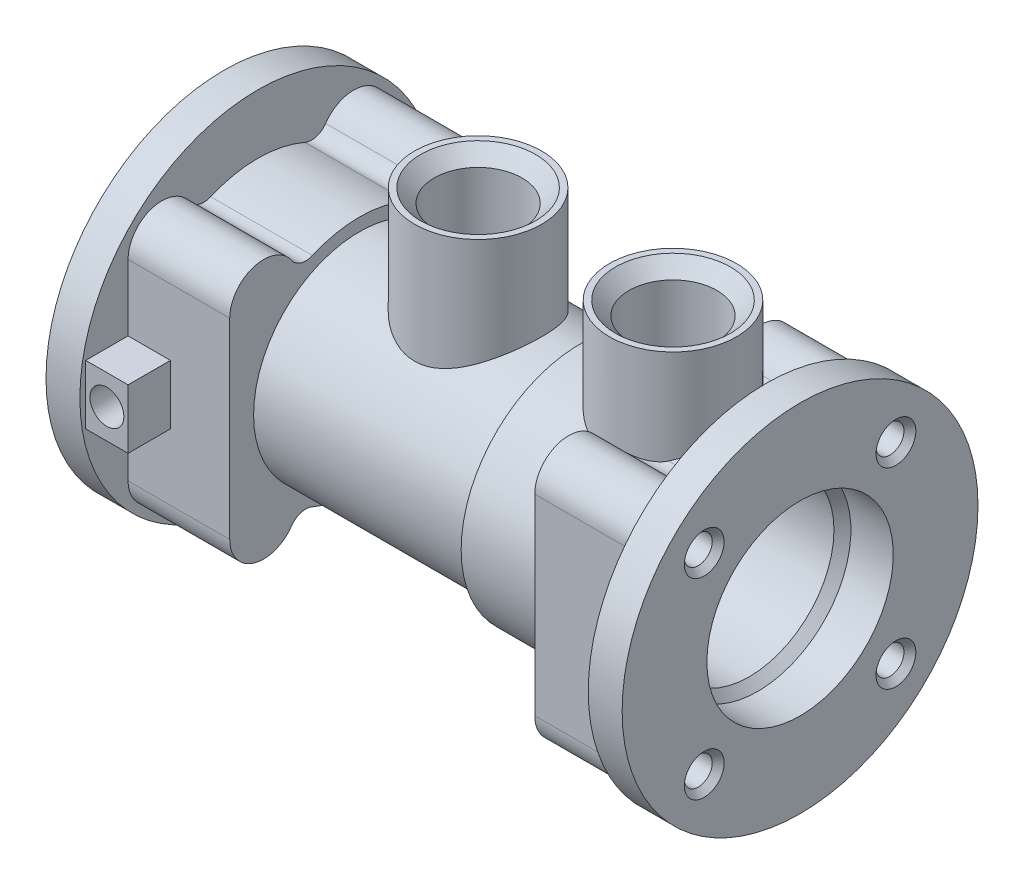
from build123d import *

# Parameters (mm, degrees)
EXTRUDE_1_DEPTH                 = 12
EXTRUDE_START                   = 12
EXTRUDE_2_DEPTH                 = 12
EXTRUDE_3_REACH                 = 86.202
EXTRUDE_3_END_RADIUS            = 12.5
SKETCH_4_R                      = 7.5
CUT_EXTRUDE_1_REACH             = 86.202
SKETCH_5_R                      = 5.188
CHAMFER_1_SIZE                  = 1.6
HOLE_WIZARD_M41_D               = 3.3
HOLE_WIZARD_M41_DEPTH           = 12
HOLE_WIZARD_M41_TIP             = 0.991420021
HOLE_WIZARD_M41_ON_FACE_2_D     = 3.3
HOLE_WIZARD_M41_ON_FACE_2_DEPTH = 12
HOLE_WIZARD_M41_ON_FACE_2_TIP   = 0.991420021
SKETCH_11_W                     = 5
SKETCH_11_H                     = 7
EXTRUDE_4_DEPTH                 = 5
CUT_EXTRUDE_2_REACH             = 85.107
CUT_EXTRUDE_2_END_RADIUS        = 10
SKETCH_12_R                     = 2
CHAMFER_2_SIZE                  = 0.7


with BuildPart() as part:
    # Эскиз1 → Повернуть1 (revolve)
    with BuildSketch(Plane.XY, mode=Mode.PRIVATE) as revolve_1_sk:
        Polygon((0, 21), (0, 11), (7, 11), (8, 10), (35, 10), (35, 9), (36, 9), (36, 8), (40.2, 8), (40.2, 6), (43, 6), (43, 10), (62, 10), (63, 11), (68, 11), (68, 21), (64, 21), (64, 14), (42, 14), (42, 12.5), (11, 12.5), (11, 14), (4, 14), (4, 21), align=None)
    revolve(revolve_1_sk.sketch.rotate(Axis((0, 0, 0), (1, 0, 0)), 90), axis=Axis((0, 0, 0), (1, 0, 0)))

    # Эскиз2 → Бобышка-Вытянуть1 (add)
    with BuildSketch(Plane(origin=(4, 0, 0), x_dir=(0, 0, -1), z_dir=(1, 0, 0))):
        with BuildLine():
            Line((15.313708499, 11.313708499), (15.313708499, 0))
            Line((15.313708499, 0), (12.5, 0))
            ThreePointArc((12.5, 0), (0, 12.5), (-12.5, 0))
            Line((-12.5, 0), (-15.313708499, 0))
            Line((-15.313708499, 0), (-15.313708499, 11.313708499))
            ThreePointArc((-15.313708499, 11.313708499), (-12.489638827, 15.136951607), (-8.005114567, 13.561642259))
            ThreePointArc((-8.005114567, 13.561642259), (-6.909147892, 12.765122929), (-5.556965401, 12.849907997))
            ThreePointArc((-5.556965401, 12.849907997), (0, 14), (5.556965401, 12.849907997))
            ThreePointArc((5.556965401, 12.849907997), (6.909147892, 12.765122929), (8.005114567, 13.561642259))
            ThreePointArc((8.005114567, 13.561642259), (12.489638827, 15.136951607), (15.313708499, 11.313708499))
        make_face()
    extrude_1 = extrude(amount=EXTRUDE_1_DEPTH)

    # Зеркальное отражение6: Бобышка-Вытянуть1 across plane
    add(extrude_1.mirror(Plane(origin=(16, 0, 12.5), x_dir=(0, 0, 1), z_dir=(0, 1, 0))))

    # Эскиз3 → Бобышка-Вытянуть2 (add)
    with BuildSketch(Plane.ZY.offset(-64).offset(EXTRUDE_START)):
        with BuildLine():
            ThreePointArc((8.005114567, 13.561642259), (6.909147892, 12.765122929), (5.556965401, 12.849907997))
            ThreePointArc((5.556965401, 12.849907997), (11.700374259, 7.687733229), (14, 0))
            ThreePointArc((14, 0), (11.700374259, -7.687733229), (5.556965401, -12.849907997))
            ThreePointArc((5.556965401, -12.849907997), (6.909147892, -12.765122929), (8.005114567, -13.561642259))
            ThreePointArc((8.005114567, -13.561642259), (12.489638827, -15.136951607), (15.313708499, -11.313708499))
            Line((15.313708499, -11.313708499), (15.313708499, 11.313708499))
            ThreePointArc((15.313708499, 11.313708499), (12.489638827, 15.136951607), (8.005114567, 13.561642259))
        make_face()
        with BuildLine():
            ThreePointArc((-8.005114567, 13.561642259), (-12.489638827, 15.136951607), (-15.313708499, 11.313708499))
            Line((-15.313708499, 11.313708499), (-15.313708499, -11.313708499))
            ThreePointArc((-15.313708499, -11.313708499), (-12.489638827, -15.136951607), (-8.005114567, -13.561642259))
            ThreePointArc((-8.005114567, -13.561642259), (-6.909147892, -12.765122929), (-5.556965401, -12.849907997))
            ThreePointArc((-5.556965401, -12.849907997), (-14, 0), (-5.556965401, 12.849907997))
            ThreePointArc((-5.556965401, 12.849907997), (-6.909147892, 12.765122929), (-8.005114567, 13.561642259))
        make_face()
    extrude(amount=-EXTRUDE_2_DEPTH)

    # Бобышка-Вытянуть3: up to this cylinder (the profile starts outside it)
    extrude_3_end = Plane(origin=(41.5, 0, 0), z_dir=(-1, 0, 0)) * Cylinder(EXTRUDE_3_END_RADIUS, 221.404, mode=Mode.PRIVATE)
    # Эскиз4 → Бобышка-Вытянуть3 (add, up to the surface)
    with BuildSketch(Plane(origin=(0, 24, 0), x_dir=(1, 0, 0), z_dir=(0, 1, 0)), mode=Mode.PRIVATE) as extrude_3_sk1:
        with Locations(Location((30, 0, 0), (0, 0, 270))):
            Circle(SKETCH_4_R)
    extrude_3_tool1 = extrude(extrude_3_sk1.sketch, amount=-EXTRUDE_3_REACH, mode=Mode.PRIVATE) - extrude_3_end
    add(extrude_3_tool1.solids().sort_by_distance((30, 24, 0))[0])
    # Эскиз4 → Бобышка-Вытянуть3 (add, up to the surface)
    with BuildSketch(Plane(origin=(0, 24, 0), x_dir=(1, 0, 0), z_dir=(0, 1, 0)), mode=Mode.PRIVATE) as extrude_3_sk2:
        with Locations(Location((53, 0, 0), (0, 0, 270))):
            Circle(SKETCH_4_R)
    extrude_3_tool2 = extrude(extrude_3_sk2.sketch, amount=-EXTRUDE_3_REACH, mode=Mode.PRIVATE) - extrude_3_end
    add(extrude_3_tool2.solids().sort_by_distance((53, 24, 0))[0])

    # Эскиз5 → Вырез-Вытянуть1 (cut, up to next)
    with BuildSketch(Plane(origin=(0, 24, 0), x_dir=(1, 0, 0), z_dir=(0, 1, 0)), mode=Mode.PRIVATE) as cut_extrude_1_sk1:
        with Locations(Location((53, 0, 0), (0, 0, 270))):
            Circle(SKETCH_5_R)
    cut_extrude_1_tool1 = extrude(cut_extrude_1_sk1.sketch, amount=-CUT_EXTRUDE_1_REACH, mode=Mode.PRIVATE) & part.part
    # Эскиз5 → Вырез-Вытянуть1 (cut, up to next)
    with BuildSketch(Plane(origin=(0, 24, 0), x_dir=(1, 0, 0), z_dir=(0, 1, 0)), mode=Mode.PRIVATE) as cut_extrude_1_sk2:
        with Locations(Location((30, 0, 0), (0, 0, 270))):
            Circle(SKETCH_5_R)
    cut_extrude_1_tool2 = extrude(cut_extrude_1_sk2.sketch, amount=-CUT_EXTRUDE_1_REACH, mode=Mode.PRIVATE) & part.part
    add(cut_extrude_1_tool1.solids().sort_by_distance((53, 24, 0))[0], mode=Mode.SUBTRACT)
    add(cut_extrude_1_tool2.solids().sort_by_distance((30, 24, 0))[0], mode=Mode.SUBTRACT)

    # Фаска1
    chamfer_1_edges = [part.edges().sort_by_distance(p)[0] for p in [
        (53, 24, -5.188),
        (30, 24, -5.188),
    ]]
    chamfer(chamfer_1_edges, length=CHAMFER_1_SIZE)

    # Отверстие обработанное метчиком M41
    with Locations(Plane(origin=(68, -11.313708499, 11.313708499), x_dir=(0, 0, 1), z_dir=(1, 0, 0))):
        with Locations((0, 0), (-22.627416998, 0), (-22.627416998, -22.627416998), (0, -22.627416998)):
            Hole(HOLE_WIZARD_M41_D / 2, depth=HOLE_WIZARD_M41_DEPTH)
            with Locations((0, 0, -(HOLE_WIZARD_M41_DEPTH + HOLE_WIZARD_M41_TIP / 2))):  # 118° drill point
                Cone(0, HOLE_WIZARD_M41_D / 2, HOLE_WIZARD_M41_TIP, mode=Mode.SUBTRACT)

    # Отверстие обработанное метчиком M41 on face 2
    with Locations(Plane(origin=(0, 11.313708499, -11.313708499), x_dir=(0, 0, -1), z_dir=(-1, 0, 0))):
        with Locations((0, 0), (0, 22.627416998), (-22.627416998, 22.627416998), (-22.627416998, 0)):
            Hole(HOLE_WIZARD_M41_ON_FACE_2_D / 2, depth=HOLE_WIZARD_M41_ON_FACE_2_DEPTH)
            with Locations((0, 0, -(HOLE_WIZARD_M41_ON_FACE_2_DEPTH + HOLE_WIZARD_M41_ON_FACE_2_TIP / 2))):  # 118° drill point
                Cone(0, HOLE_WIZARD_M41_ON_FACE_2_D / 2, HOLE_WIZARD_M41_ON_FACE_2_TIP, mode=Mode.SUBTRACT)

    # Эскиз11 → Бобышка-Вытянуть4 (add)
    with BuildSketch(Plane.XY.offset(15.313708499)):
        with Locations((6.5, 0)):
            Rectangle(SKETCH_11_W, SKETCH_11_H)
    extrude(amount=EXTRUDE_4_DEPTH)

    # Вырез-Вытянуть2: up to this cylinder (the profile starts outside it)
    cut_extrude_2_end = Plane(origin=(6.5, 0, 0), z_dir=(-1, 0, 0)) * Cylinder(CUT_EXTRUDE_2_END_RADIUS, 191.214, mode=Mode.PRIVATE)
    # Эскиз12 → Вырез-Вытянуть2 (cut, up to the surface)
    with BuildSketch(Plane.XY.offset(20.313708499), mode=Mode.PRIVATE) as cut_extrude_2_sk1:
        with Locations((6.5, 0)):
            Circle(SKETCH_12_R)
    cut_extrude_2_tool1 = extrude(cut_extrude_2_sk1.sketch, amount=-CUT_EXTRUDE_2_REACH, mode=Mode.PRIVATE) - cut_extrude_2_end
    add(cut_extrude_2_tool1.solids().sort_by_distance((6.5, 0, 20.313708))[0], mode=Mode.SUBTRACT)

    # Фаска2
    chamfer_2_edges = [part.edges().sort_by_distance(p)[0] for p in [
        (0, 11.313708499, 9.663708499),
        (0, -11.313708499, 9.663708499),
        (0, -11.313708499, -12.963708499),
        (0, 11.313708499, -12.963708499),
        (68, 11.313708499, 12.963708499),
        (68, 11.313708499, -9.663708499),
        (68, -11.313708499, -9.663708499),
        (68, -11.313708499, 12.963708499),
    ]]
    chamfer(chamfer_2_edges, length=CHAMFER_2_SIZE)


solid = part.part
